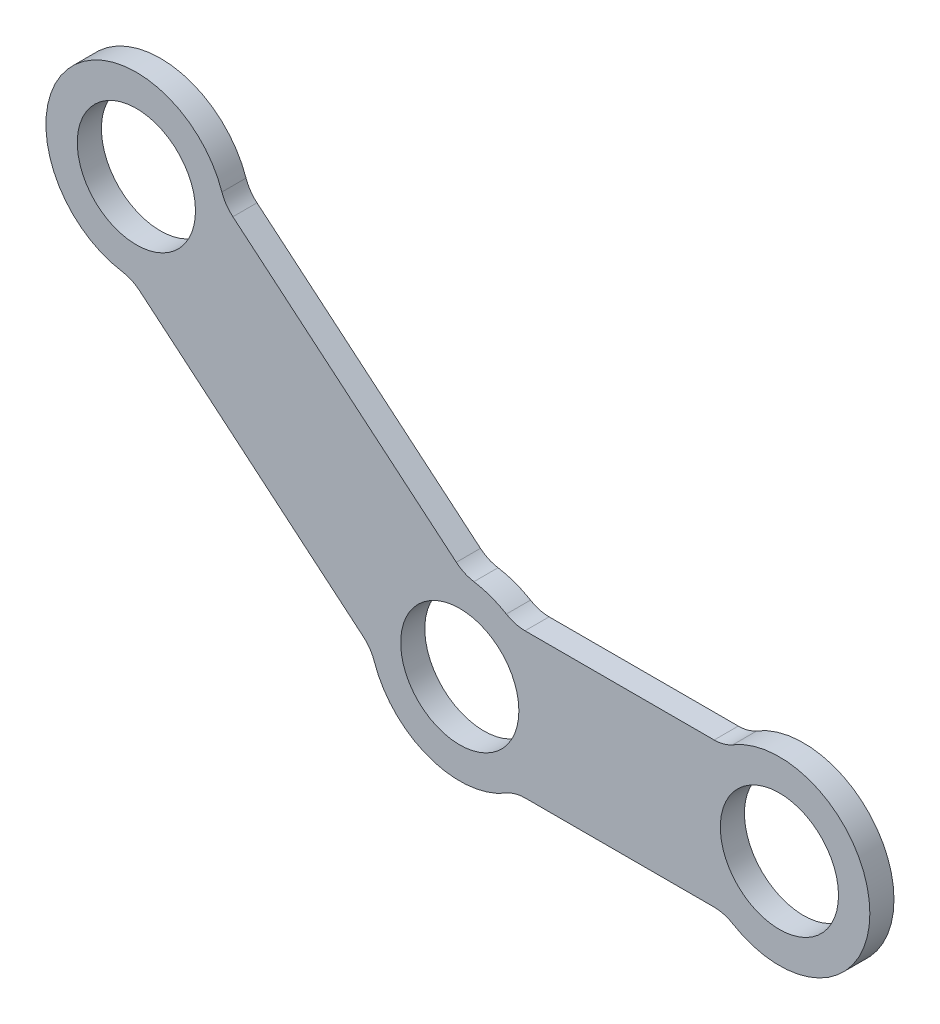
from build123d import *

# Parameters (mm, degrees)
SKETCH1_R           = 4.9
BOSS_EXTRUDE1_DEPTH = 2
FILLET1_R           = 3


with BuildPart() as part:
    # Sketch1 → Boss-Extrude1 (new body)
    with BuildSketch(Plane.XY):
        with BuildLine():
            Line((4.5, -6), (22, -6))
            ThreePointArc((22, -6), (34, 0), (22, 6))
            Line((22, 6), (4.5, 6))
            ThreePointArc((4.5, 6), (2.565151075, 7.047694656), (0.409525664, 7.488810902))
            Line((0.409525664, 7.488810902), (-19.507629857, 24.201288754))
            ThreePointArc((-19.507629857, 24.201288754), (-32.556888833, 27.318473412), (-27.221081173, 15.008755437))
            Line((-27.221081173, 15.008755437), (-7.303925652, -1.703722415))
            ThreePointArc((-7.303925652, -1.703722415), (-2.565151075, -7.047694656), (4.5, -6))
        make_face()
        Circle(SKETCH1_R, mode=Mode.SUBTRACT)
        with Locations((26.5, 0)):
            Circle(SKETCH1_R, mode=Mode.SUBTRACT)
        with Locations((-26.811555509, 22.497566339)):
            Circle(SKETCH1_R, mode=Mode.SUBTRACT)
    extrude(amount=BOSS_EXTRUDE1_DEPTH)

    # Fillet1
    fillet1_edges = [part.edges().sort_by_distance(p)[0] for p in [
        (-19.507629857, 24.201288754, 1),
        (0.409525664, 7.488810902, 1),
        (4.5, 6, 1),
        (22, 6, 1),
        (22, -6, 1),
        (4.5, -6, 1),
        (-7.303925652, -1.703722415, 1),
        (-27.221081173, 15.008755437, 1),
    ]]
    fillet(fillet1_edges, radius=FILLET1_R)


solid = part.part
